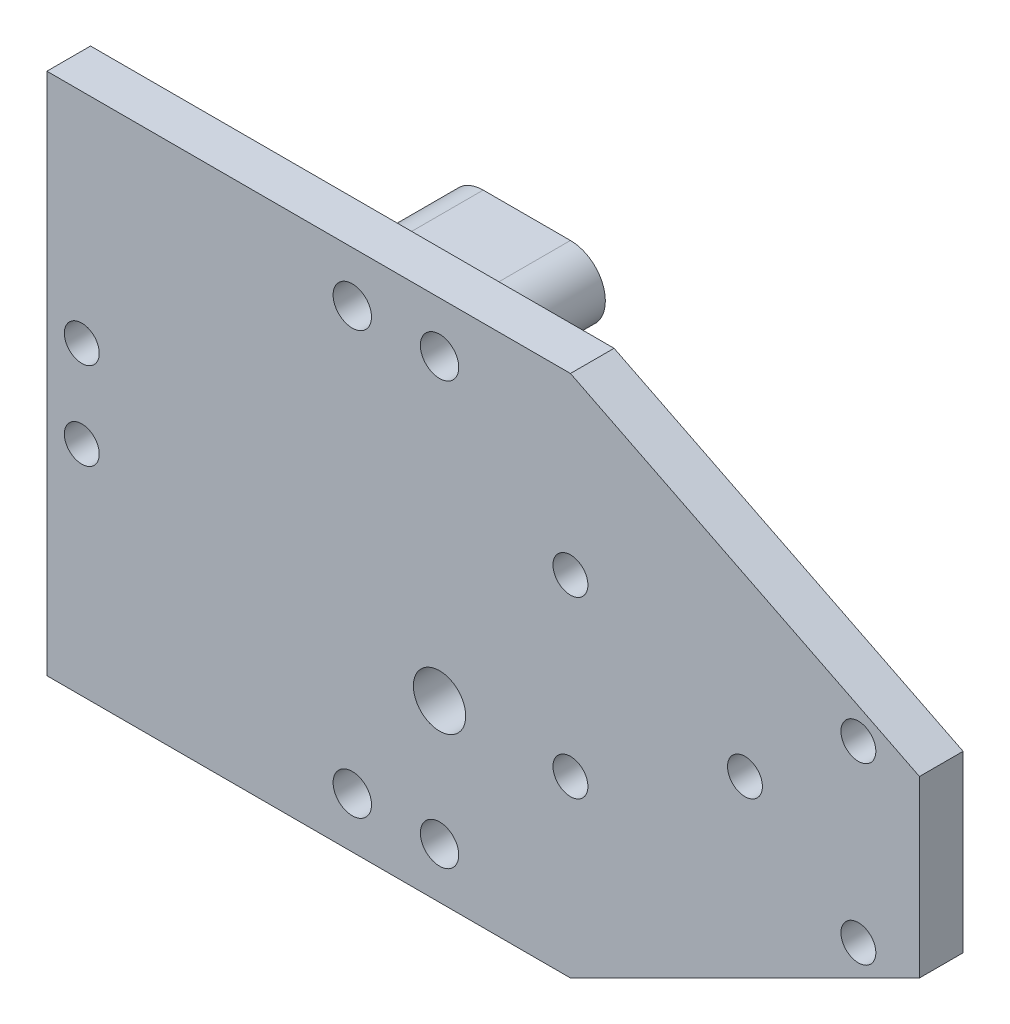
from build123d import *

# Parameters (mm, degrees)
SKETCH_1_R          = 2
SKETCH_1_R_2        = 3
SKETCH_1_R_3        = 2.2
EXTRUDE_1_DEPTH     = 2.5
SKETCH_2_R          = 2
CUT_EXTRUDE_1_DEPTH = 2.5
EXTRUDE_START       = -15
SKETCH_3_R          = 2.2
EXTRUDE_2_DEPTH     = 10


with BuildPart() as part:
    # 草图1 → 凸台-拉伸1 (new, symmetric)
    with BuildSketch(Plane.XY):
        Polygon((0, -20), (60, -20), (100, 0), (100, 20), (60, 40), (0, 40), align=None)
        with Locations((60, 20)):
            Circle(SKETCH_1_R, mode=Mode.SUBTRACT)
        with Locations((60, 0)):
            Circle(SKETCH_1_R, mode=Mode.SUBTRACT)
        with Locations((93, 20)):
            Circle(SKETCH_1_R, mode=Mode.SUBTRACT)
        with Locations((93, 0)):
            Circle(SKETCH_1_R, mode=Mode.SUBTRACT)
        with Locations((45, 0)):
            Circle(SKETCH_1_R_2, mode=Mode.SUBTRACT)
        with Locations((45, 34.2)):
            Circle(SKETCH_1_R_3, mode=Mode.SUBTRACT)
        with Locations((45, -14.2)):
            Circle(SKETCH_1_R_3, mode=Mode.SUBTRACT)
        with Locations((35, 34.2)):
            Circle(SKETCH_1_R_3, mode=Mode.SUBTRACT)
        with Locations((35, -14.2)):
            Circle(SKETCH_1_R_3, mode=Mode.SUBTRACT)
    extrude(amount=EXTRUDE_1_DEPTH, both=True)

    # 草图2 → 切除-拉伸1 (cut, symmetric)
    with BuildSketch(Plane.XY):
        with Locations((80, 10)):
            Circle(SKETCH_2_R)
        with Locations((4, 5)):
            Circle(SKETCH_2_R)
        with Locations((4, 15)):
            Circle(SKETCH_2_R)
    extrude(amount=CUT_EXTRUDE_1_DEPTH, both=True, mode=Mode.SUBTRACT)

    # 草图3 → 凸台-拉伸2 (add)
    # profile 1 of 2: a face of its own
    with BuildSketch(Plane.XY.offset(2.5).offset(EXTRUDE_START)):
        with BuildLine():
            Line((35, 38.2), (45, 38.2))
            ThreePointArc((45, 38.2), (49, 34.2), (45, 30.2))
            Line((45, 30.2), (35, 30.2))
            ThreePointArc((35, 30.2), (31, 34.2), (35, 38.2))
        make_face()
        with Locations((35, 34.2)):
            Circle(SKETCH_3_R, mode=Mode.SUBTRACT)
        with Locations((45, 34.2)):
            Circle(SKETCH_3_R, mode=Mode.SUBTRACT)
    # profile 2 of 2: a face of its own
    with BuildSketch(Plane.XY.offset(2.5).offset(EXTRUDE_START)):
        with BuildLine():
            Line((35, -10.2), (45, -10.2))
            ThreePointArc((45, -10.2), (49, -14.2), (45, -18.2))
            Line((45, -18.2), (35, -18.2))
            ThreePointArc((35, -18.2), (31, -14.2), (35, -10.2))
        make_face()
        with Locations((35, -14.2)):
            Circle(SKETCH_3_R, mode=Mode.SUBTRACT)
        with Locations((45, -14.2)):
            Circle(SKETCH_3_R, mode=Mode.SUBTRACT)
    extrude(amount=EXTRUDE_2_DEPTH)


solid = part.part
